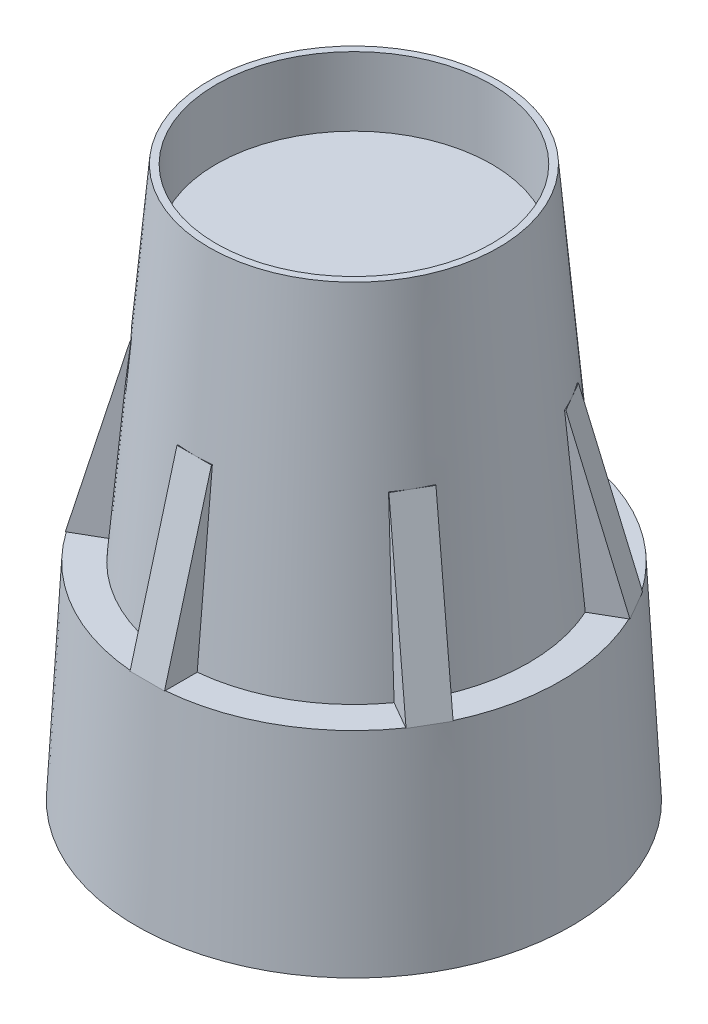
from build123d import *

# Parameters (mm, degrees)
SKETCH1_R           = 21
BOSS_EXTRUDE1_DEPTH = 50
BOSS_EXTRUDE1_DRAFT = 5
SKETCH2_R           = 30
BOSS_EXTRUDE2_DEPTH = 30
BOSS_EXTRUDE2_DRAFT = -3
BOSS_EXTRUDE3_DEPTH = 2.5
CIRPATTERN1_COUNT   = 6
SKETCH4_R           = 27.291330602
SKETCH4_R_2         = 23.594608396
CUT_EXTRUDE1_DEPTH  = 3
CUT_EXTRUDE1_DRAFT  = -10
SKETCH5_R           = 19.382333363
SKETCH5_R_2         = 16.172751495
CUT_EXTRUDE2_DEPTH  = 2.5
CUT_EXTRUDE2_DRAFT  = -10
SKETCH6_R           = 10.925848264
BOSS_EXTRUDE4_DEPTH = 2.5
BOSS_EXTRUDE4_TAPER = 30
SKETCH7_R           = 20
CUT_EXTRUDE3_DEPTH  = 10


with BuildPart() as part:
    # Sketch1 → Boss-Extrude1 (with draft: the straight prism first)
    with BuildSketch(Plane(origin=(0, 0, 0), x_dir=(1, 0, 0), z_dir=(0, 1, 0))):
        Circle(SKETCH1_R)
    extrude(amount=-BOSS_EXTRUDE1_DEPTH)
    # Boss-Extrude1: the draft: its side faces are tilted about the plane it starts from
    boss_extrude1_sides = [part.faces().sort_by_distance(p)[0] for p in [
        (-21, -25, 0),
    ]]
    draft(boss_extrude1_sides, Plane(origin=(0, 0, 0), x_dir=(1, 0, 0), z_dir=(0, 1, 0)), BOSS_EXTRUDE1_DRAFT)


with BuildPart() as boss_extrude2_tool:
    # Sketch2 → Boss-Extrude2 (with draft: the straight prism first)
    with BuildSketch(Plane.XZ.offset(50)):
        Circle(SKETCH2_R)
    extrude(amount=BOSS_EXTRUDE2_DEPTH)
    # Boss-Extrude2: the draft: its side faces are tilted about the plane it starts from
    boss_extrude2_sides = [boss_extrude2_tool.faces().sort_by_distance(p)[0] for p in [
        (-30, -65, 0),
    ]]
    draft(boss_extrude2_sides, Plane.XZ.offset(50), BOSS_EXTRUDE2_DRAFT)


with BuildPart() as part_1:
    add(part.part)

    # Boss-Extrude2: add boss_extrude2_tool
    add(boss_extrude2_tool.part)

    # Sketch3 → Boss-Extrude3 (add, symmetric)
    with BuildSketch(Plane(origin=(0, 0, 0), x_dir=(0, 0, -1), z_dir=(1, 0, 0))):
        Polygon((-25.374433176, -50), (-30, -50), (-23.187216588, -25), (-20.280513913, -25), (-22.467730501, -50), align=None)
    boss_extrude3 = extrude(amount=BOSS_EXTRUDE3_DEPTH, both=True)

    # CirPattern1: Boss-Extrude3 ×6 about axis
    cirpattern1_axis = Axis((0, 0, 0), (0, 1, 0))
    for i in range(1, CIRPATTERN1_COUNT):
        add(boss_extrude3.rotate(cirpattern1_axis, i * 360 / CIRPATTERN1_COUNT))


with BuildPart() as cut_extrude1_tool:
    # Sketch4 → Cut-Extrude1 (with draft: the straight prism first)
    with BuildSketch(Plane.XZ.offset(80)):
        Circle(SKETCH4_R)
        Circle(SKETCH4_R_2, mode=Mode.SUBTRACT)
    extrude(amount=-CUT_EXTRUDE1_DEPTH)
    # Cut-Extrude1: the draft: its side faces are tilted about the plane it starts from
    cut_extrude1_sides = [cut_extrude1_tool.faces().sort_by_distance(p)[0] for p in [
        (-27.291330602, -78.5, 0),
        (-23.594608396, -78.5, 0),
    ]]
    draft(cut_extrude1_sides, Plane.XZ.offset(80), CUT_EXTRUDE1_DRAFT)


with BuildPart() as part_2:
    add(part_1.part)

    # Cut-Extrude1: cut by cut_extrude1_tool
    add(cut_extrude1_tool.part, mode=Mode.SUBTRACT)


with BuildPart() as cut_extrude2_tool:
    # Sketch5 → Cut-Extrude2 (with draft: the straight prism first)
    with BuildSketch(Plane.XZ.offset(80)):
        Circle(SKETCH5_R)
        Circle(SKETCH5_R_2, mode=Mode.SUBTRACT)
    extrude(amount=-CUT_EXTRUDE2_DEPTH)
    # Cut-Extrude2: the draft: its side faces are tilted about the plane it starts from
    cut_extrude2_sides = [cut_extrude2_tool.faces().sort_by_distance(p)[0] for p in [
        (-19.382333363, -78.75, 0),
        (-16.172751495, -78.75, 0),
    ]]
    draft(cut_extrude2_sides, Plane.XZ.offset(80), CUT_EXTRUDE2_DRAFT)


with BuildPart() as part_3:
    add(part_2.part)

    # Cut-Extrude2: cut by cut_extrude2_tool
    add(cut_extrude2_tool.part, mode=Mode.SUBTRACT)

    # Sketch6 → Boss-Extrude4 (add)
    with BuildSketch(Plane.XZ.offset(80)):
        Circle(SKETCH6_R)
    extrude(amount=BOSS_EXTRUDE4_DEPTH, taper=BOSS_EXTRUDE4_TAPER)

    # Sketch7 → Cut-Extrude3 (cut)
    with BuildSketch(Plane(origin=(0, 0, 0), x_dir=(1, 0, 0), z_dir=(0, 1, 0))):
        with Locations(Location((0, 0, 0), (0, 0, 270))):
            Circle(SKETCH7_R)
    extrude(amount=-CUT_EXTRUDE3_DEPTH, mode=Mode.SUBTRACT)


solid = part_3.part
